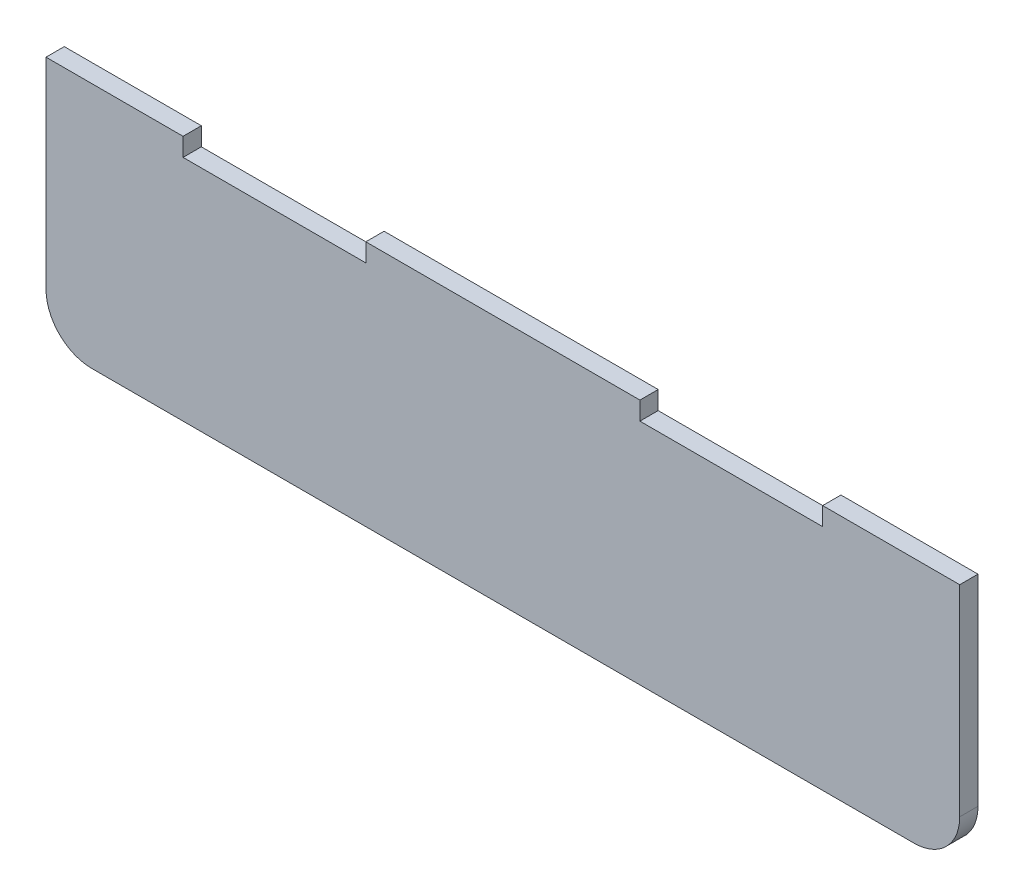
from build123d import *

# Parameters (mm, degrees)
BOSS_EXTRUDE1_DEPTH = 4


with BuildPart() as part:
    # Sketch1 → Boss-Extrude1 (new body)
    with BuildSketch(Plane.XY):
        with BuildLine():
            Line((10, 0), (190, 0))
            ThreePointArc((190, 0), (197.071067812, 2.928932188), (200, 10))
            Line((200, 10), (200, 50))
            Line((200, 50), (200, 54))
            Line((200, 54), (170, 54))
            Line((170, 54), (170, 50))
            Line((170, 50), (130, 50))
            Line((130, 50), (130, 54))
            Line((130, 54), (70, 54))
            Line((70, 54), (70, 50))
            Line((70, 50), (30, 50))
            Line((30, 50), (30, 54))
            Line((30, 54), (0, 54))
            Line((0, 54), (0, 50))
            Line((0, 50), (0, 10))
            ThreePointArc((0, 10), (2.928932188, 2.928932188), (10, 0))
        make_face()
    extrude(amount=BOSS_EXTRUDE1_DEPTH)


solid = part.part
